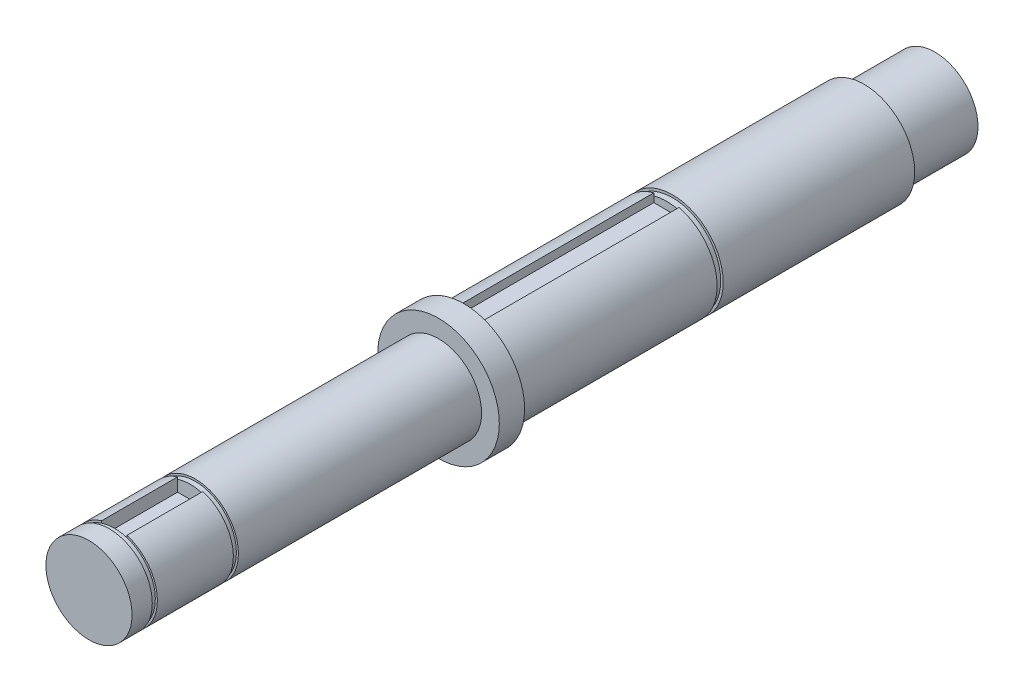
from build123d import *

# Parameters (mm, degrees)
CUT_EXTRUDE1_START  = -19
SKETCH3_W           = 5
SKETCH3_H           = 8
CUT_EXTRUDE1_DEPTH  = 40
SKETCH4_R           = 12.5
SKETCH4_R_2         = 9.5
CUT_EXTRUDE2_DEPTH  = 1.2
SKETCH5_R           = 8.5
BOSS_EXTRUDE1_DEPTH = 50
SKETCH8_W           = 5
SKETCH8_H           = 3
CUT_EXTRUDE3_DEPTH  = 15
SKETCH9_R           = 8.5
BOSS_EXTRUDE2_DEPTH = 5
SKETCH10_R          = 10.1
SKETCH10_R_2        = 8.1
CUT_EXTRUDE4_DEPTH  = 1
CUT_EXTRUDE5_START  = -1
SKETCH11_R          = 10.1
SKETCH11_R_2        = 8.1
CUT_EXTRUDE5_DEPTH  = 1


with BuildPart() as part:
    # Sketch2 → Revolve1 (revolve)
    with BuildSketch(Plane(origin=(0, 0, 0), x_dir=(0, 0, -1), z_dir=(1, 0, 0)), mode=Mode.PRIVATE) as revolve1_sk:
        Polygon((0, 0), (0, 8.5), (14, 8.5), (14, 12), (19, 12), (19, 10), (98, 10), (98, 8.5), (112, 8.5), (112, 0), align=None)
    revolve(revolve1_sk.sketch.rotate(Axis((0, 0, 0), (0, 0, -1)), 90), axis=Axis((0, 0, 0), (0, 0, -1)))

    # Sketch3 → Cut-Extrude1 (cut)
    with BuildSketch(Plane.XY.offset(CUT_EXTRUDE1_START)):
        with Locations((0, 12)):
            Rectangle(SKETCH3_W, SKETCH3_H)
    extrude(amount=-CUT_EXTRUDE1_DEPTH, mode=Mode.SUBTRACT)

    # Sketch4 → Cut-Extrude2 (cut)
    with BuildSketch(Plane.XY.offset(-59)):
        Circle(SKETCH4_R)
        Circle(SKETCH4_R_2, mode=Mode.SUBTRACT)
    extrude(amount=-CUT_EXTRUDE2_DEPTH, mode=Mode.SUBTRACT)

    # Sketch5 → Boss-Extrude1 (add)
    with BuildSketch(Plane.XY):
        Circle(SKETCH5_R)
    extrude(amount=BOSS_EXTRUDE1_DEPTH)

    # Sketch8 → Cut-Extrude3 (cut)
    with BuildSketch(Plane.XY.offset(50)):
        with Locations((0, 7)):
            Rectangle(SKETCH8_W, SKETCH8_H)
    extrude(amount=-CUT_EXTRUDE3_DEPTH, mode=Mode.SUBTRACT)

    # Sketch9 → Boss-Extrude2 (add)
    with BuildSketch(Plane.XY.offset(50)):
        Circle(SKETCH9_R)
    extrude(amount=BOSS_EXTRUDE2_DEPTH)

    # Sketch10 → Cut-Extrude4 (cut)
    with BuildSketch(Plane(origin=(0, 0, 50), x_dir=(-1, 0, 0), z_dir=(0, 0, -1))):
        Circle(SKETCH10_R)
        Circle(SKETCH10_R_2, mode=Mode.SUBTRACT)
    extrude(amount=-CUT_EXTRUDE4_DEPTH, mode=Mode.SUBTRACT)

    # Sketch11 → Cut-Extrude5 (cut)
    with BuildSketch(Plane.XY.offset(35).offset(CUT_EXTRUDE5_START)):
        Circle(SKETCH11_R)
        Circle(SKETCH11_R_2, mode=Mode.SUBTRACT)
    extrude(amount=CUT_EXTRUDE5_DEPTH, mode=Mode.SUBTRACT)


solid = part.part
